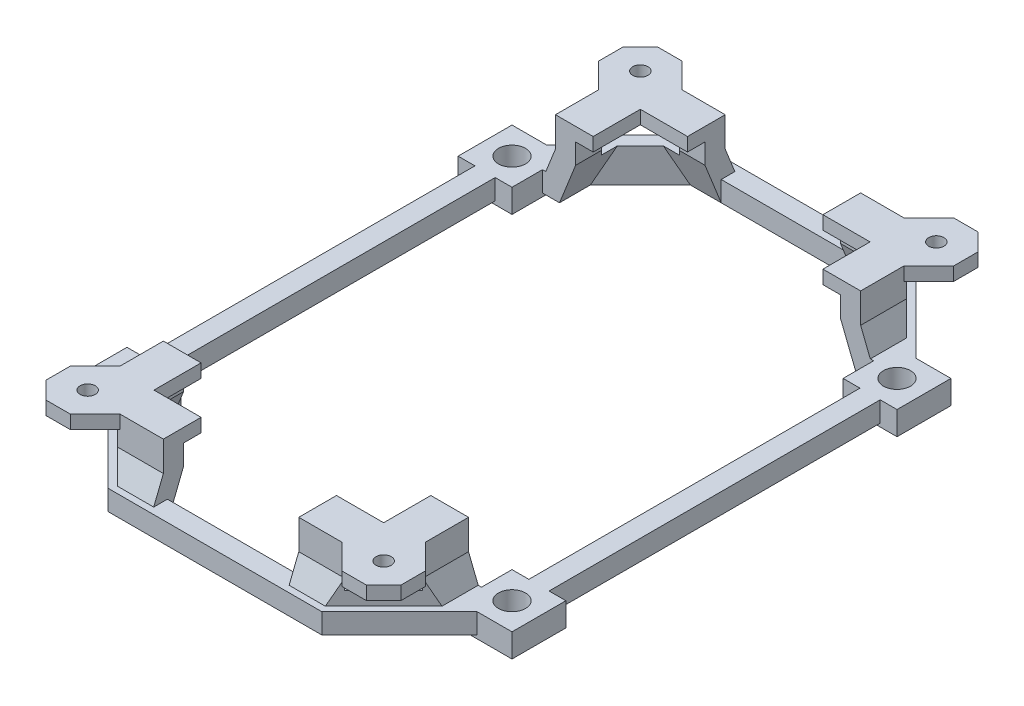
from build123d import *

# Parameters (mm, degrees)
BOSS_EXTRUDE1_DEPTH            = 6
BOSS_EXTRUDE2_DEPTH            = 1
BOSS_EXTRUDE3_DEPTH            = 12.05
SKETCH4_R                      = 2.25
BOSS_EXTRUDE4_DEPTH            = 4
CUT_EXTRUDE1_REACH             = 87.707
SKETCH5_W                      = 16.364675298
SKETCH5_H                      = 8
CUT_EXTRUDE1_DIRECTION_2_DEPTH = 86.707273439
CUT_EXTRUDE2_DEPTH             = 9.171573
CUT_EXTRUDE3_REACH             = 114.79
SKETCH8_W                      = 3.39411255
SKETCH8_H                      = 10.05
CUT_EXTRUDE3_DIRECTION_2_REACH = 114.79
BOSS_EXTRUDE5_DEPTH            = 13.628427
CUT_EXTRUDE4_DEPTH             = 113.7898768
SKETCH12_R                     = 4.0132
CUT_EXTRUDE5_DEPTH             = 113.888407941


with BuildPart() as part:
    # Sketch1 → Boss-Extrude1 (new body)
    with BuildSketch(Plane(origin=(0, 0, 0), x_dir=(1, 0, 0), z_dir=(0, 1, 0))):
        Polygon((-54.15, 0), (-60.15, 0), (-60.15, -49.15), (-65.15, -49.15), (-65.15, -65.15), (-54.806854249, -65.15), (-31.756854249, -88.2), (0, -88.2), (0, -82.2), (-20.1, -82.2), (-20.1, -77.4), (-31.243145751, -77.4), (-39.3, -69.343145751), (-39.3, -58.2), (-49.15, -58.2), (-49.15, -49.15), (-54.15, -49.15), align=None)
    extrude(amount=BOSS_EXTRUDE1_DEPTH)

    # Sketch2 → Boss-Extrude2 (add)
    with BuildSketch(Plane.XZ):
        Polygon((-49.15, 58.2), (-49.15, 49.15), (-65.15, 49.15), (-65.15, 65.15), (-49.15, 65.15), align=None)
    extrude(amount=BOSS_EXTRUDE2_DEPTH)

    # Sketch3 → Boss-Extrude3 (add)
    with BuildSketch(Plane(origin=(0, 6, 0), x_dir=(1, 0, 0), z_dir=(0, 1, 0))):
        Polygon((-39.3, -58.2), (-45.3, -58.2), (-45.3, -71.828427125), (-33.728427125, -83.4), (-20.1, -83.4), (-20.1, -77.4), (-31.243145751, -77.4), (-39.3, -69.343145751), align=None)
    extrude(amount=BOSS_EXTRUDE3_DEPTH)

    # Sketch4 → Boss-Extrude4 (add)
    with BuildSketch(Plane(origin=(0, 18.05, 0), x_dir=(1, 0, 0), z_dir=(0, 1, 0))):
        Polygon((-45.3, -58.2), (-34.1, -58.2), (-34.1, -72.2), (-20.1, -72.2), (-20.1, -83.4), (-32.925631329, -83.4), (-40.309262274, -90.783630945), (-47.557999616, -90.783630945), (-52.683630945, -85.657999616), (-52.683630945, -78.409262274), (-45.3, -71.025631329), align=None)
        with Locations(Location((-43.933630945, -82.033630945, 0), (0, 0, 270))):
            Circle(SKETCH4_R, mode=Mode.SUBTRACT)
    extrude(amount=BOSS_EXTRUDE4_DEPTH)

    # Sketch5 → Cut-Extrude1 (cut, up to next)
    with BuildSketch(Plane(origin=(-58.564213562, 0, 58.564213562), x_dir=(0.7071067811865475, 0, 0.7071067811865477), z_dir=(-0.7071067811865477, 0, 0.7071067811865475)), mode=Mode.PRIVATE) as cut_extrude1_sk1:
        with Locations((26.940768363, 14.05)):
            Rectangle(SKETCH5_W, SKETCH5_H)
    cut_extrude1_tool1 = extrude(cut_extrude1_sk1.sketch, amount=-CUT_EXTRUDE1_REACH, mode=Mode.PRIVATE) & part.part
    add(cut_extrude1_tool1.solids().sort_by_distance((-39.514214, 14.05, 77.614214))[0], mode=Mode.SUBTRACT)

    # Sketch5 → Cut-Extrude1 direction 2 (cut)
    with BuildSketch(Plane(origin=(-58.564213562, 0, 58.564213562), x_dir=(0.7071067811865475, 0, 0.7071067811865477), z_dir=(-0.7071067811865477, 0, 0.7071067811865475))):
        with Locations((26.940768363, 14.05)):
            Rectangle(SKETCH5_W, SKETCH5_H)
    extrude(amount=CUT_EXTRUDE1_DIRECTION_2_DEPTH, mode=Mode.SUBTRACT)

    # Sketch6 → Cut-Extrude2 (cut)
    with BuildSketch(Plane(origin=(-20.1, 0, 0), x_dir=(0, 0, -1), z_dir=(1, 0, 0))):
        Polygon((-82.2, 0), (-77.4, 12.05), (-77.4, 0), align=None)
    cut_extrude2 = extrude(amount=-CUT_EXTRUDE2_DEPTH, mode=Mode.SUBTRACT)

    # Mirror1: Cut-Extrude2 across plane
    add(cut_extrude2.mirror(Plane(origin=(19.05, 0, 19.05), x_dir=(-0.7071067811865477, 0, 0.7071067811865474), z_dir=(0.7071067811865476, 0, 0.7071067811865476))), mode=Mode.SUBTRACT)

    # Cut-Extrude3: up to this plane
    cut_extrude3_end = Plane(origin=(-44.1, 0, 67.371572875), z_dir=(0.9290074363039443, -0.3700610534654694, 0))
    # Sketch8 → Cut-Extrude3 (cut, up to the surface)
    with BuildSketch(Plane(origin=(19.05, 0, 19.05), x_dir=(0.7071067811865476, 0, -0.7071067811865476), z_dir=(0.7071067811865476, 0, 0.7071067811865476)), mode=Mode.PRIVATE) as cut_extrude3_sk1:
        with Locations((-77.125248815, 5.025)):
            Rectangle(SKETCH8_W, SKETCH8_H)
    cut_extrude3_tool1 = split(extrude(cut_extrude3_sk1.sketch, amount=-CUT_EXTRUDE3_REACH, mode=Mode.PRIVATE), bisect_by=cut_extrude3_end, keep=Keep.BOTH, mode=Mode.PRIVATE)
    add(cut_extrude3_tool1.solids().sort_by_distance((-35.485786, 5.025, 73.585786))[0], mode=Mode.SUBTRACT)

    # Cut-Extrude3 direction 2: up to this plane
    cut_extrude3_direction_2_end = Plane(origin=(-29.271572875, 0, 82.2), z_dir=(0, 0.3700610534654694, 0.9290074363039443))
    # Sketch8 → Cut-Extrude3 direction 2 (cut, up to the surface)
    with BuildSketch(Plane(origin=(19.05, 0, 19.05), x_dir=(0.7071067811865476, 0, -0.7071067811865476), z_dir=(0.7071067811865476, 0, 0.7071067811865476)), mode=Mode.PRIVATE) as cut_extrude3_direction_2_sk1:
        with Locations((-77.125248815, 5.025)):
            Rectangle(SKETCH8_W, SKETCH8_H)
    cut_extrude3_direction_2_tool1 = split(extrude(cut_extrude3_direction_2_sk1.sketch, amount=CUT_EXTRUDE3_DIRECTION_2_REACH, mode=Mode.PRIVATE), bisect_by=cut_extrude3_direction_2_end, keep=Keep.BOTH, mode=Mode.PRIVATE)
    add(cut_extrude3_direction_2_tool1.solids().sort_by_distance((-35.485786, 5.025, 73.585786))[0], mode=Mode.SUBTRACT)

    # Sketch10 → Boss-Extrude5 (add)
    with BuildSketch(Plane(origin=(-20.1, 0, 0), x_dir=(0, 0, -1), z_dir=(1, 0, 0))):
        Polygon((-83.4, 13.20104083), (-86.268464397, 6), (-83.4, 6), align=None)
    boss_extrude5 = extrude(amount=-BOSS_EXTRUDE5_DEPTH)

    # Sketch11 → Cut-Extrude4 (cut, through all)
    with BuildSketch(Plane(origin=(19.05, 0, 19.05), x_dir=(0.7071067811865476, 0, -0.7071067811865476), z_dir=(0.7071067811865476, 0, 0.7071067811865476))):
        Polygon((-82.82230509, 13.20104083), (-84.850615716, 6), (-82.82230509, 6), align=None)
    cut_extrude4 = extrude(amount=CUT_EXTRUDE4_DEPTH, mode=Mode.SUBTRACT)

    # Mirror2: Boss-Extrude5, Cut-Extrude4 across plane
    add(boss_extrude5.mirror(Plane(origin=(19.05, 0, 19.05), x_dir=(-0.7071067811865477, 0, 0.7071067811865474), z_dir=(0.7071067811865476, 0, 0.7071067811865476))))
    add(cut_extrude4.mirror(Plane(origin=(19.05, 0, 19.05), x_dir=(-0.7071067811865477, 0, 0.7071067811865474), z_dir=(0.7071067811865476, 0, 0.7071067811865476))), mode=Mode.SUBTRACT)

    # Sketch12 → Cut-Extrude5 (cut, through all)
    with BuildSketch(Plane(origin=(0, 6, 0), x_dir=(1, 0, 0), z_dir=(0, 1, 0))):
        with Locations(Location((-57.15, -57.15, 0), (0, 0, 270))):
            Circle(SKETCH12_R)
    extrude(amount=-CUT_EXTRUDE5_DEPTH, mode=Mode.SUBTRACT)

    # Mirror3: part across plane


with BuildPart() as part_1:
    add(part.part)
    add(part.part.mirror(Plane(origin=(-54.15, 6, 0), x_dir=(1, 0, 0), z_dir=(0, 0, 1))))

    # Mirror4: part across plane


with BuildPart() as part_2:
    add(part_1.part)
    add(part_1.part.mirror(Plane(origin=(0, 6, -88.2), x_dir=(0, 0, 1), z_dir=(-1, 0, 0))))


solid = part_2.part
